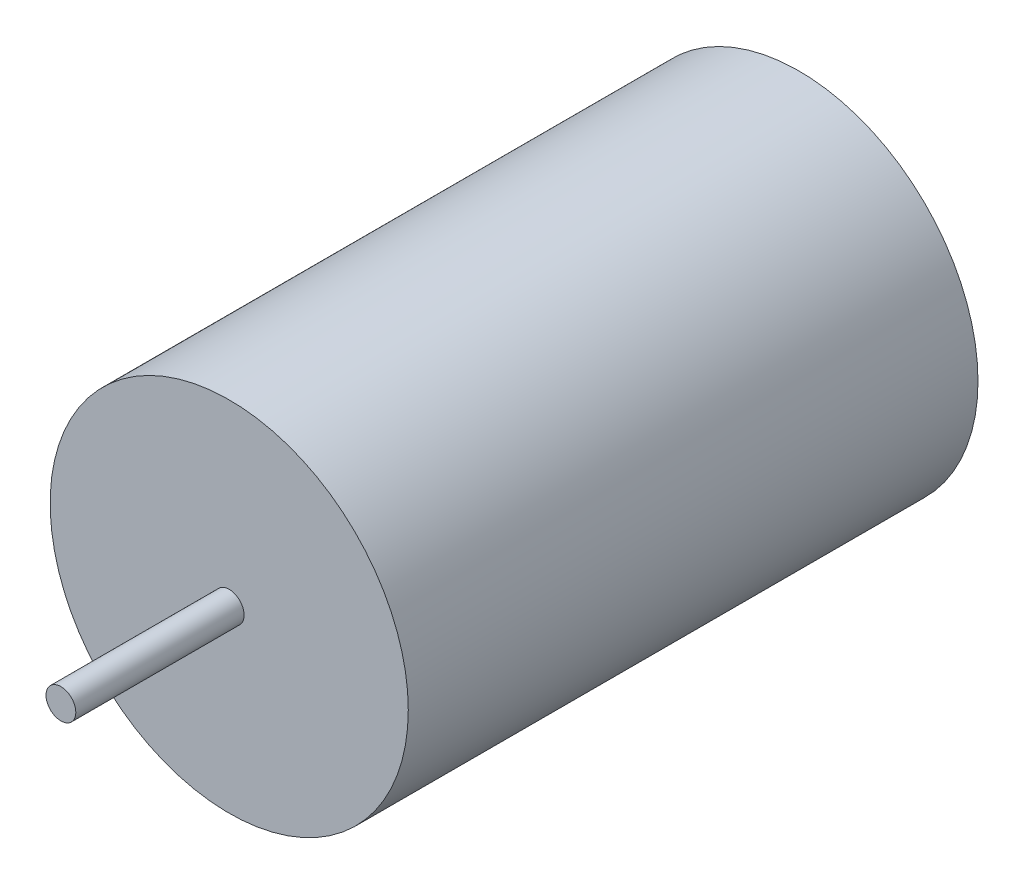
from build123d import *

# Parameters (mm, degrees)
SKETCH1_R           = 13.83
BOSS_EXTRUDE1_DEPTH = 44
SKETCH2_R           = 1.15
BOSS_EXTRUDE2_DEPTH = 13


with BuildPart() as part:
    # Sketch1 → Boss-Extrude1 (new body)
    with BuildSketch(Plane.XY):
        Circle(SKETCH1_R)
    extrude(amount=BOSS_EXTRUDE1_DEPTH)

    # Sketch2 → Boss-Extrude2 (add)
    with BuildSketch(Plane.XY.offset(44)):
        with Locations(Location((0, 0, 0), (0, 0, 180))):
            Circle(SKETCH2_R)
    extrude(amount=BOSS_EXTRUDE2_DEPTH)


solid = part.part
